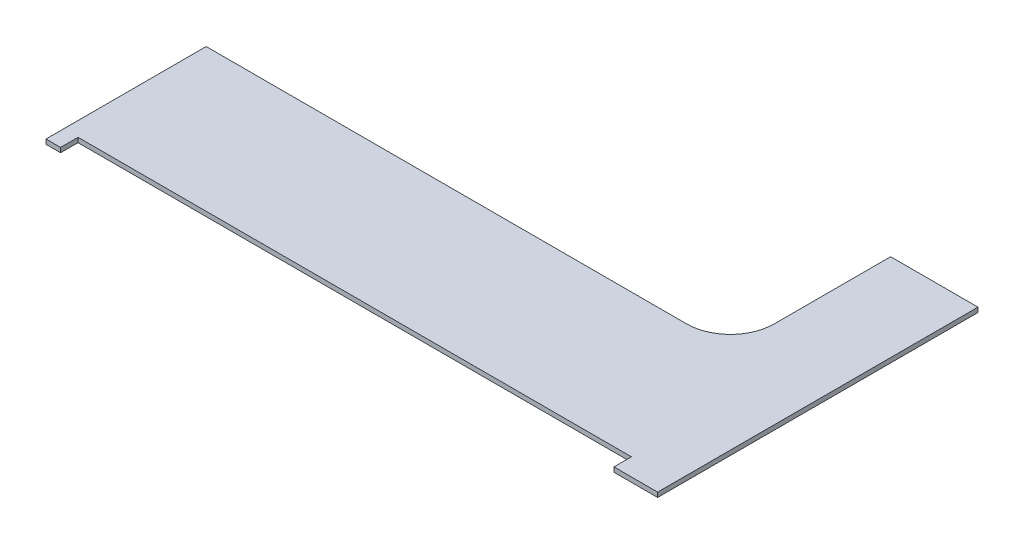
from build123d import *

# Parameters (mm, degrees)
AUFSATZ_LINEAR_AUSTRAGEN1_DEPTH = 16
SKIZZE2_W                       = 1900
SKIZZE2_H                       = 60
SCHNITT_LINEAR_AUSTRAGEN1_DEPTH = 2371.707911152


with BuildPart() as part:
    # Skizze1 → Aufsatz-Linear austragen1 (new body)
    with BuildSketch(Plane(origin=(0, 0, 0), x_dir=(1, 0, 0), z_dir=(0, 1, 0))):
        with BuildLine():
            Line((2100, 0), (2100, 1100))
            Line((2100, 1100), (1800, 1100))
            Line((1800, 1100), (1800, 700))
            ThreePointArc((1800, 700), (1756.066017178, 593.933982822), (1650, 550))
            Line((1650, 550), (0, 550))
            Line((0, 550), (0, 0))
            Line((0, 0), (2100, 0))
        make_face()
    extrude(amount=AUFSATZ_LINEAR_AUSTRAGEN1_DEPTH)

    # Skizze2 → Schnitt-Linear austragen1 (cut, through all)
    with BuildSketch(Plane(origin=(0, 16, 0), x_dir=(1, 0, 0), z_dir=(0, 1, 0))):
        with Locations((1000, 30)):
            Rectangle(SKIZZE2_W, SKIZZE2_H)
    extrude(amount=-SCHNITT_LINEAR_AUSTRAGEN1_DEPTH, mode=Mode.SUBTRACT)


solid = part.part
